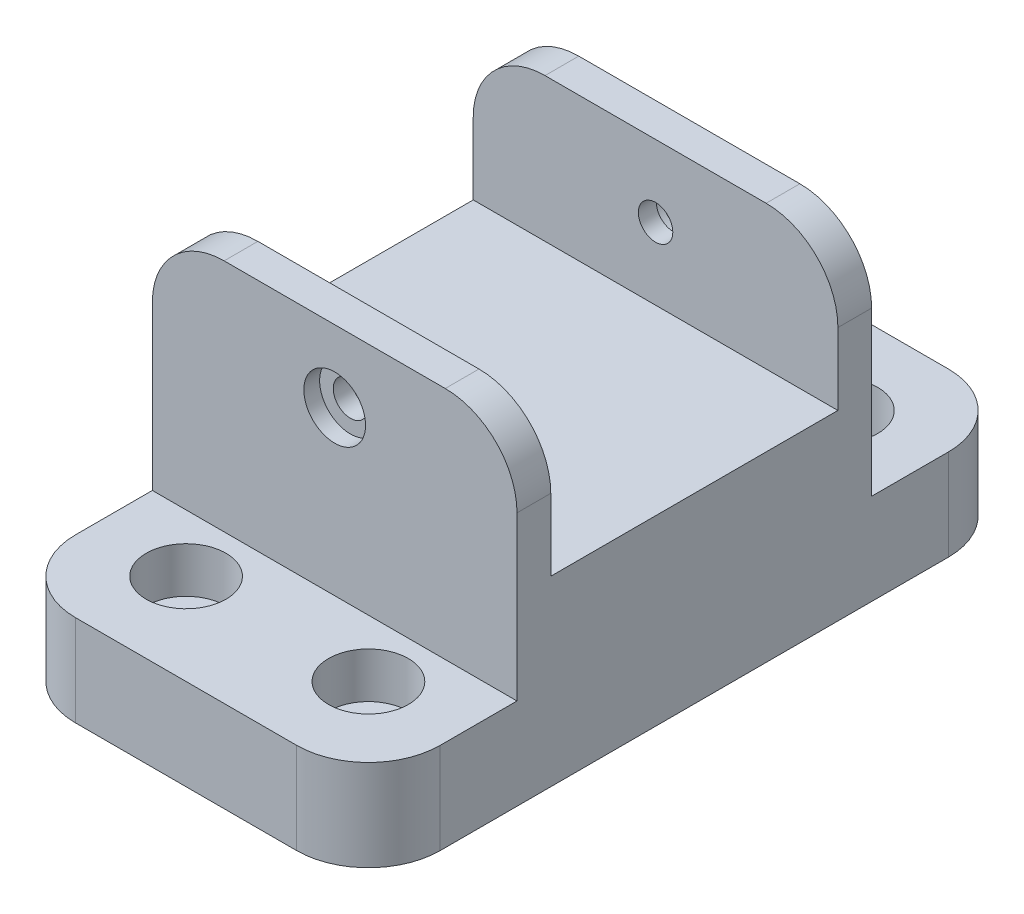
from build123d import *

# Parameters (mm, degrees)
SKETCH1_W                                        = 50.8
SKETCH1_H                                        = 25.4
BOSS_EXTRUDE1_DEPTH                              = 25.4
CBORE_FOR_1_4_SOCKET_HEAD_CAP_SCREW1_D           = 6.7564
CBORE_FOR_1_4_SOCKET_HEAD_CAP_SCREW1_CBORE_D     = 11.1125
CBORE_FOR_1_4_SOCKET_HEAD_CAP_SCREW1_CBORE_DEPTH = 19.05
SKETCH6_W                                        = 50.8
SKETCH6_H                                        = 4.7
BOSS_EXTRUDE2_DEPTH                              = 20
CBORE_FOR_M4_SBHCS1_D                            = 4.8
CBORE_FOR_M4_SBHCS1_CBORE_D                      = 8.6
CBORE_FOR_M4_SBHCS1_CBORE_DEPTH                  = 2.2
FILLET1_R                                        = 10
SKETCH15_W                                       = 50.8
SKETCH15_H                                       = 25.4
BOSS_EXTRUDE3_DEPTH                              = 20
SKETCH16_W                                       = 51.113320751
SKETCH16_H                                       = 27.993322013
CUT_EXTRUDE2_DEPTH                               = 12.7


with BuildPart() as part:
    # Sketch1 → Boss-Extrude1 (new body)
    with BuildSketch(Plane(origin=(0, 0, 0), x_dir=(1, 0, 0), z_dir=(0, 1, 0))):
        with Locations((2.315568022, 7.890743338)):
            Rectangle(SKETCH1_W, SKETCH1_H)
    extrude(amount=BOSS_EXTRUDE1_DEPTH)

    # CBORE for 1/4 Socket Head Cap Screw1 (through all)
    with Locations(Plane(origin=(0, 25.4, 0), x_dir=(1, 0, 0), z_dir=(0, 1, 0))):
        with Locations((-10.384431978, 7.890743338), (15.015568022, 7.890743338)):
            CounterBoreHole(CBORE_FOR_1_4_SOCKET_HEAD_CAP_SCREW1_D / 2, CBORE_FOR_1_4_SOCKET_HEAD_CAP_SCREW1_CBORE_D / 2, CBORE_FOR_1_4_SOCKET_HEAD_CAP_SCREW1_CBORE_DEPTH)

    # Sketch6 → Boss-Extrude2 (add)
    with BuildSketch(Plane(origin=(0, 25.4, 0), x_dir=(1, 0, 0), z_dir=(0, 1, 0))):
        with Locations((2.315568022, 18.240743338)):
            Rectangle(SKETCH6_W, SKETCH6_H)
    extrude(amount=BOSS_EXTRUDE2_DEPTH)

    # CBORE for M4 SBHCS1 (through all)
    with Locations(Plane.XY.offset(-15.890743338)):
        with Locations((2.315568022, 35.4)):
            CounterBoreHole(CBORE_FOR_M4_SBHCS1_D / 2, CBORE_FOR_M4_SBHCS1_CBORE_D / 2, CBORE_FOR_M4_SBHCS1_CBORE_DEPTH)

    # Fillet1
    fillet1_edges = [part.edges().sort_by_distance(p)[0] for p in [
        (27.715568022, 45.4, -18.240743338),
        (-23.084431978, 45.4, -18.240743338),
        (27.715568022, 12.7, 4.809256662),
        (-23.084431978, 12.7, 4.809256662),
    ]]
    fillet(fillet1_edges, radius=FILLET1_R)

    # Sketch15 → Boss-Extrude3 (add)
    with BuildSketch(Plane(origin=(0, 0, -20.590743338), x_dir=(-1, 0, 0), z_dir=(0, 0, -1))):
        with Locations((-2.315568022, 12.7)):
            Rectangle(SKETCH15_W, SKETCH15_H)
    extrude(amount=BOSS_EXTRUDE3_DEPTH)

    # Sketch16 → Cut-Extrude2 (cut)
    with BuildSketch(Plane(origin=(0, 25.4, 0), x_dir=(1, 0, 0), z_dir=(0, 1, 0))):
        with Locations((2.472228398, 1.894082332)):
            Rectangle(SKETCH16_W, SKETCH16_H)
    extrude(amount=-CUT_EXTRUDE2_DEPTH, mode=Mode.SUBTRACT)

    # Mirror1: part across plane


with BuildPart() as part_1:
    add(part.part)
    add(part.part.mirror(Plane(origin=(0, 0, -40.590743338), x_dir=(1, 0, 0), z_dir=(0, 0, -1))))


solid = part_1.part
